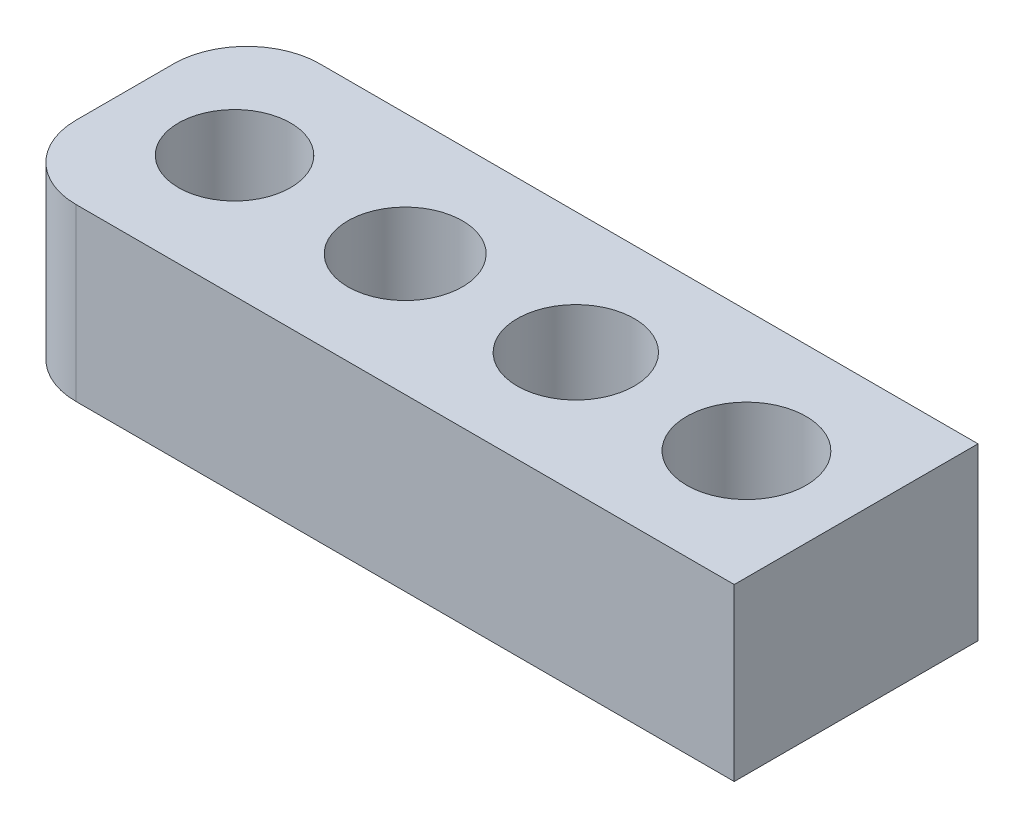
from build123d import *

# Parameters (mm, degrees)
SKETCH1_W           = 30
SKETCH1_H           = 10
SKETCH1_R           = 2.3
SKETCH1_R_2         = 2.35
SKETCH1_R_3         = 2.4
SKETCH1_R_4         = 2.45
BOSS_EXTRUDE1_DEPTH = 7
FILLET1_R           = 3


with BuildPart() as part:
    # Sketch1 → Boss-Extrude1 (new body)
    with BuildSketch(Plane(origin=(0, 0, 0), x_dir=(1, 0, 0), z_dir=(0, 1, 0))):
        with Locations((15, 5)):
            Rectangle(SKETCH1_W, SKETCH1_H)
        with Locations(Location((4.5, 5, 0), (0, 0, 270))):
            Circle(SKETCH1_R, mode=Mode.SUBTRACT)
        with Locations(Location((11.5, 5, 0), (0, 0, 270))):
            Circle(SKETCH1_R_2, mode=Mode.SUBTRACT)
        with Locations(Location((18.5, 5, 0), (0, 0, 270))):
            Circle(SKETCH1_R_3, mode=Mode.SUBTRACT)
        with Locations(Location((25.5, 5, 0), (0, 0, 270))):
            Circle(SKETCH1_R_4, mode=Mode.SUBTRACT)
    extrude(amount=BOSS_EXTRUDE1_DEPTH)

    # Fillet1
    fillet1_edges = [part.edges().sort_by_distance(p)[0] for p in [
        (0, 3.5, -10),
        (0, 3.5, 0),
    ]]
    fillet(fillet1_edges, radius=FILLET1_R)


solid = part.part
